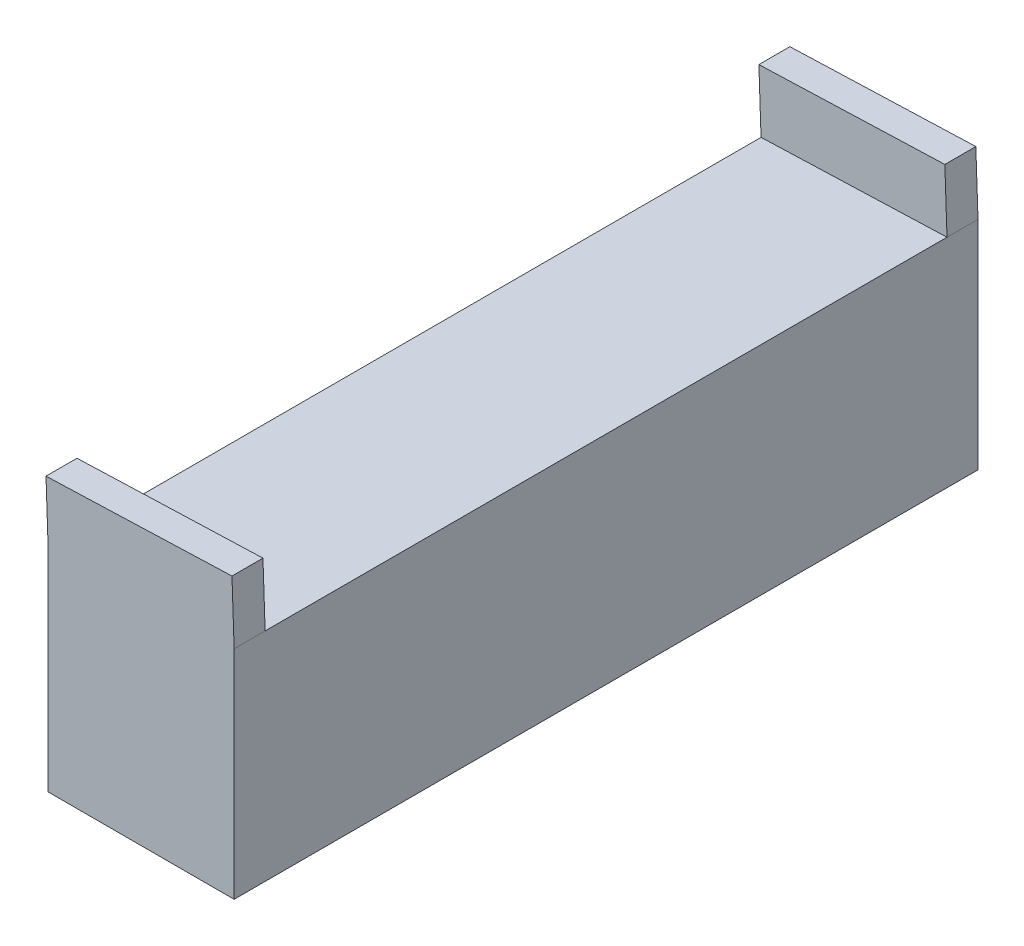
from build123d import *

# Parameters (mm, degrees)
SKETCH_1_W          = 30
SKETCH_1_H          = 120
EXTRUDE_1_DEPTH     = 35
CUT_EXTRUDE_1_DEPTH = 750.235385976
SKETCH_4_W          = 30.018286329
SKETCH_4_H          = 5
EXTRUDE_2_DEPTH     = 10


with BuildPart() as part:
    # Эскиз1 → Бобышка-Вытянуть1 (new body)
    with BuildSketch(Plane(origin=(708.734501427, 0, -6544.760847934), x_dir=(1, 0, 0), z_dir=(0, 1, 0))):
        with Locations((15, -60)):
            Rectangle(SKETCH_1_W, SKETCH_1_H)
    extrude(amount=EXTRUDE_1_DEPTH)

    # Эскиз3 → Вырез-Вытянуть1 (cut, through all)
    with BuildSketch(Plane.XY.offset(-6424.760847934)):
        Polygon((738.734501427, 35), (708.734501427, 33.952376915), (708.734501427, 35), align=None)
    extrude(amount=-CUT_EXTRUDE_1_DEPTH, mode=Mode.SUBTRACT)

    # Эскиз4 → Бобышка-Вытянуть2 (add)
    with BuildSketch(Plane(origin=(-0.320978232, 9.191613953, 0), x_dir=(0.9993908270190961, 0.03489949670249378, 0), z_dir=(-0.03489949670249378, 0.9993908270190961, 0))):
        with Locations((724.496823549, 6542.260847934)):
            Rectangle(SKETCH_4_W, SKETCH_4_H)
        with Locations((724.496823549, 6427.260847934)):
            Rectangle(SKETCH_4_W, SKETCH_4_H)
    extrude(amount=EXTRUDE_2_DEPTH)


solid = part.part
